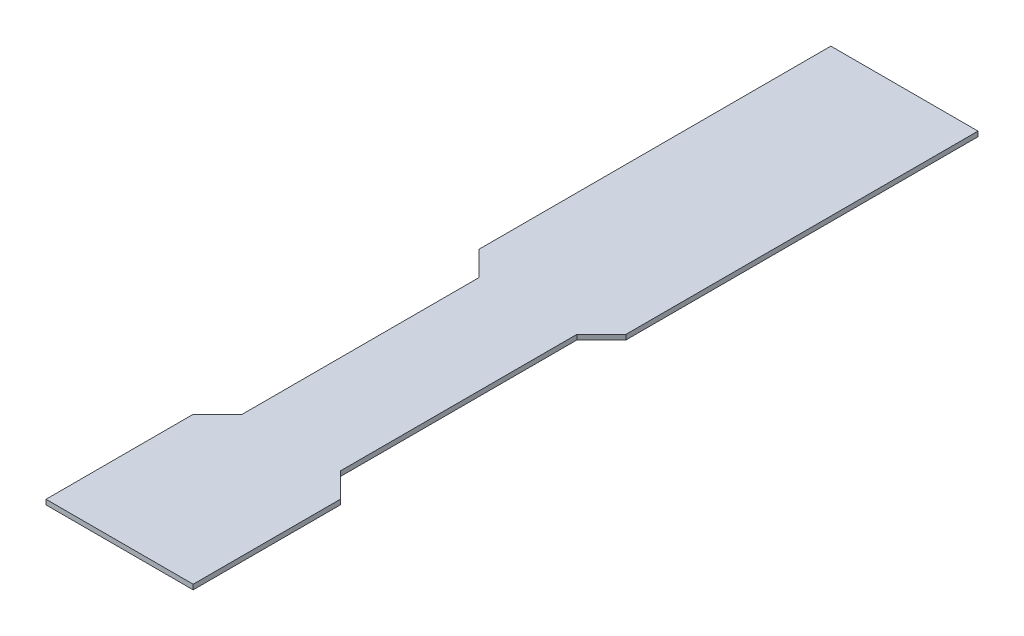
from build123d import *

# Parameters (mm, degrees)
EXTRUDE_1_DEPTH = 2


with BuildPart() as part:
    # 草图1 → 凸台-拉伸1 (new body)
    with BuildSketch(Plane(origin=(0, 0, 0), x_dir=(1, 0, 0), z_dir=(0, 1, 0))):
        Polygon((-30, -260), (-30, -320), (30, -320), (30, -260), (20, -250), (20, -240), (20, -153.5), (30, -143.5), (30, 0), (-30, 0), (-30, -143.5), (-20, -153.5), (-20, -240), (-20, -250), align=None)
    extrude(amount=EXTRUDE_1_DEPTH)


solid = part.part
